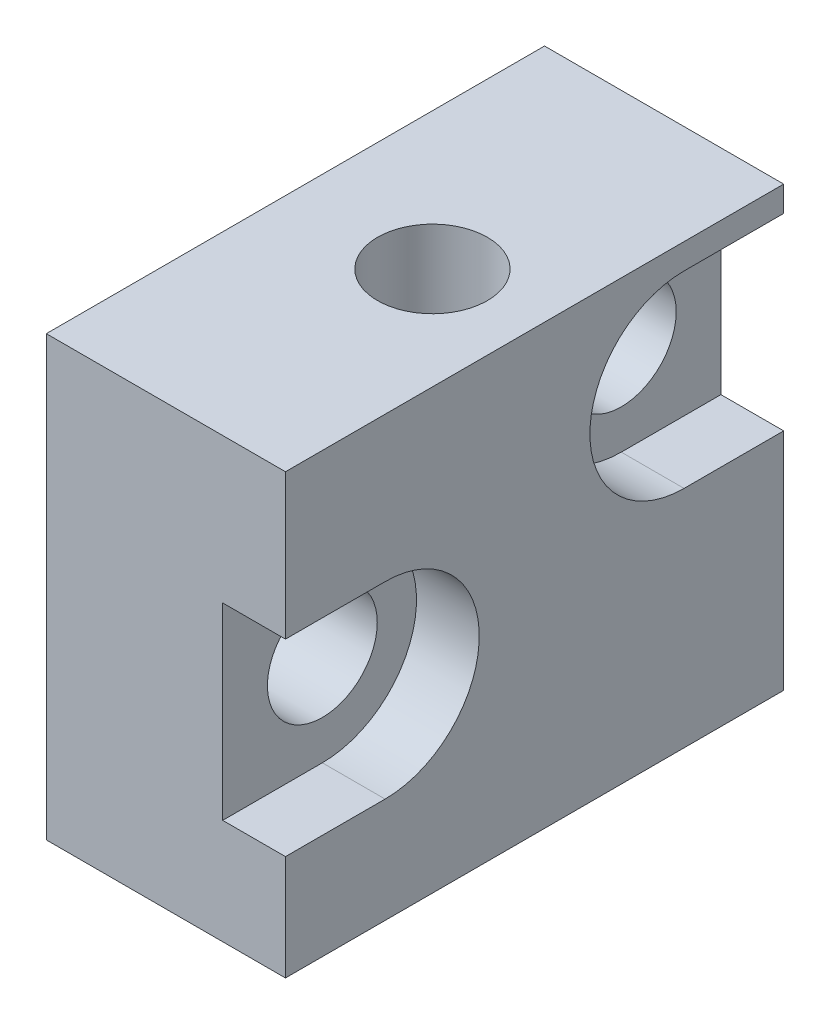
from build123d import *

# Parameters (mm, degrees)
SKETCH1_W           = 11.43
SKETCH1_H           = 15.875
BOSS_EXTRUDE1_DEPTH = 7.62
SKETCH3_R           = 1.75
CUT_EXTRUDE1_DEPTH  = 22.2885
SKETCH4_R           = 1.75
CUT_EXTRUDE2_DEPTH  = 22.2885
SKETCH5_R           = 3
SKETCH5_R_2         = 1.75
CUT_EXTRUDE3_DEPTH  = 2
SKETCH6_W           = 2.54
SKETCH6_H           = 15.875
BOSS_EXTRUDE2_DEPTH = 7.62
CUT_EXTRUDE4_START  = -18.796
SKETCH8_R           = 1.75
CUT_EXTRUDE4_DEPTH  = 18.796


with BuildPart() as part:
    # Sketch1 → Boss-Extrude1 (new body)
    with BuildSketch(Plane.YZ):
        Rectangle(SKETCH1_W, SKETCH1_H)
    extrude(amount=BOSS_EXTRUDE1_DEPTH)

    # Sketch3 → Cut-Extrude1 (cut)
    with BuildSketch(Plane.XZ.offset(5.715)):
        with Locations(Location((4.36625, 0, 0), (0, 0, 270))):
            Circle(SKETCH3_R)
    extrude(amount=-CUT_EXTRUDE1_DEPTH, mode=Mode.SUBTRACT)

    # Sketch4 → Cut-Extrude2 (cut)
    with BuildSketch(Plane.YZ.offset(7.62)):
        with Locations(Location((-1.905, 4.7625, 0), (0, 0, 270))):
            Circle(SKETCH4_R)
        with Locations(Location((1.905, -4.7625, 0), (0, 0, 270))):
            Circle(SKETCH4_R)
    extrude(amount=-CUT_EXTRUDE2_DEPTH, mode=Mode.SUBTRACT)

    # Sketch5 → Cut-Extrude3 (cut)
    # profile 1 of 4: a face of its own
    with BuildSketch(Plane.YZ.offset(7.62)):
        with Locations((-1.905, 4.7625)):
            Circle(SKETCH5_R)
        with Locations(Location((-1.905, 4.7625, 0), (0, 0, 270))):
            Circle(SKETCH5_R_2, mode=Mode.SUBTRACT)
    # profile 2 of 4: a face of its own
    with BuildSketch(Plane.YZ.offset(7.62)):
        with BuildLine():
            Line((-4.905, 7.9375), (-4.905, 4.7625))
            ThreePointArc((-4.905, 4.7625), (-1.905, 7.7625), (1.095, 4.7625))
            Line((1.095, 4.7625), (1.095, 7.9375))
            Line((1.095, 7.9375), (-4.905, 7.9375))
        make_face()
    # profile 3 of 4: a face of its own
    with BuildSketch(Plane.YZ.offset(7.62)):
        with Locations((1.905, -4.7625)):
            Circle(SKETCH5_R)
        with Locations(Location((1.905, -4.7625, 0), (0, 0, 270))):
            Circle(SKETCH5_R_2, mode=Mode.SUBTRACT)
    # profile 4 of 4: a face of its own
    with BuildSketch(Plane.YZ.offset(7.62)):
        with BuildLine():
            Line((4.905, -7.9375), (4.905, -4.7625))
            ThreePointArc((4.905, -4.7625), (1.905, -7.7625), (-1.095, -4.7625))
            Line((-1.095, -4.7625), (-1.095, -7.9375))
            Line((-1.095, -7.9375), (4.905, -7.9375))
        make_face()
    extrude(amount=-CUT_EXTRUDE3_DEPTH, mode=Mode.SUBTRACT)

    # Sketch6 → Boss-Extrude2 (add)
    with BuildSketch(Plane.YZ.offset(7.62)):
        with Locations((-6.985, 0)):
            Rectangle(SKETCH6_W, SKETCH6_H)
    extrude(amount=-BOSS_EXTRUDE2_DEPTH)

    # Sketch8 → Cut-Extrude4 (cut)
    with BuildSketch(Plane(origin=(0, 5.715, 0), x_dir=(-1, 0, 0), z_dir=(0, 1, 0)).offset(CUT_EXTRUDE4_START)):
        with Locations(Location((-4.36625, 0, 0), (0, 0, 270))):
            Circle(SKETCH8_R)
    extrude(amount=CUT_EXTRUDE4_DEPTH, mode=Mode.SUBTRACT)


solid = part.part
